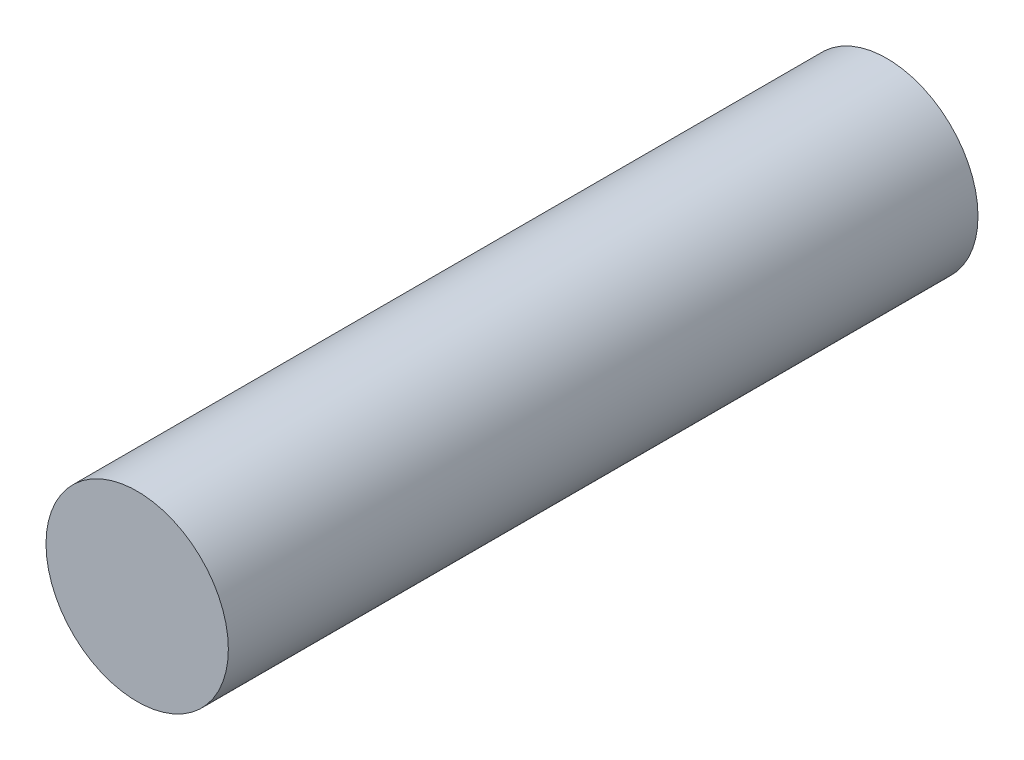
from build123d import *

# Parameters (mm, degrees)
SKETCH1_R           = 2.25
BOSS_EXTRUDE1_DEPTH = 18.5


with BuildPart() as part:
    # Sketch1 → Boss-Extrude1 (new body)
    with BuildSketch(Plane.XY):
        Circle(SKETCH1_R)
    extrude(amount=BOSS_EXTRUDE1_DEPTH)


solid = part.part
